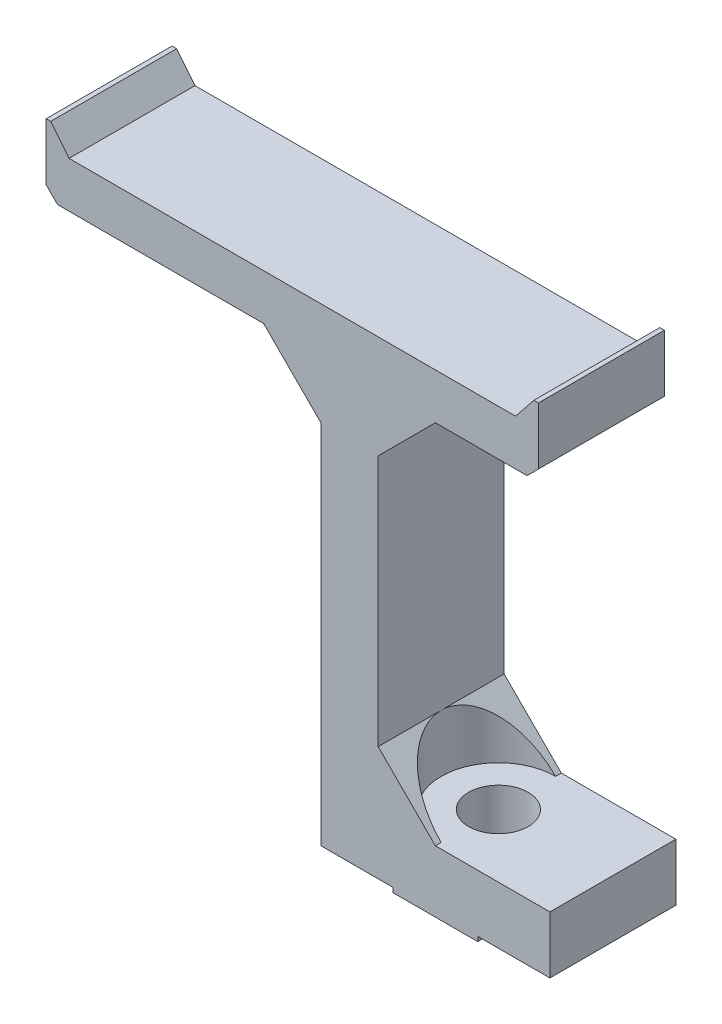
from build123d import *

# Parameters (mm, degrees)
EXTRUDE_1_DEPTH     = 11
CHAMFER_2_SIZE      = 5
CHAMFER_3_SIZE      = 1
SKETCH_2_R          = 2.6
CUT_EXTRUDE_1_DEPTH = 53.163205423
SKETCH_3_R          = 5
CUT_EXTRUDE_2_DEPTH = 5


with BuildPart() as part:
    # Эскиз1 → Бобышка-Вытянуть1 (new body)
    with BuildSketch(Plane.XY):
        Polygon((-10, 0.4), (-3.7, 0.4), (-3.7, 0), (3.7, 0), (3.7, 0.4), (10, 0.4), (10, 5.4), (-5, 5.4), (-5, 37.4), (9, 37.4), (9, 43.4), (8.6, 43.4), (7, 41.4), (-32, 41.4), (-33.6, 43.4), (-34, 43.4), (-34, 37.4), (-10, 37.4), align=None)
    extrude(amount=EXTRUDE_1_DEPTH)

    # Фаска2
    chamfer_2_edges = [part.edges().sort_by_distance(p)[0] for p in [
        (-10, 37.4, 5.5),
        (-5, 37.4, 5.5),
        (-5, 5.4, 5.5),
    ]]
    chamfer(chamfer_2_edges, length=CHAMFER_2_SIZE)

    # Фаска3
    chamfer_3_edges = [part.edges().sort_by_distance(p)[0] for p in [
        (-34, 37.4, 5.5),
        (9, 37.4, 5.5),
    ]]
    chamfer(chamfer_3_edges, length=CHAMFER_3_SIZE)

    # Эскиз2 → Вырез-Вытянуть1 (cut, through all)
    with BuildSketch(Plane(origin=(0, 5.4, 0), x_dir=(1, 0, 0), z_dir=(0, 1, 0))):
        with Locations(Location((0, -5.5, 0), (0, 0, 180))):
            Circle(SKETCH_2_R)
    extrude(amount=-CUT_EXTRUDE_1_DEPTH, mode=Mode.SUBTRACT)

    # Эскиз3 → Вырез-Вытянуть2 (cut)
    with BuildSketch(Plane(origin=(0, 5.4, 0), x_dir=(1, 0, 0), z_dir=(0, 1, 0))):
        with Locations((0, -5.5)):
            Circle(SKETCH_3_R)
    extrude(amount=CUT_EXTRUDE_2_DEPTH, mode=Mode.SUBTRACT)


solid = part.part
